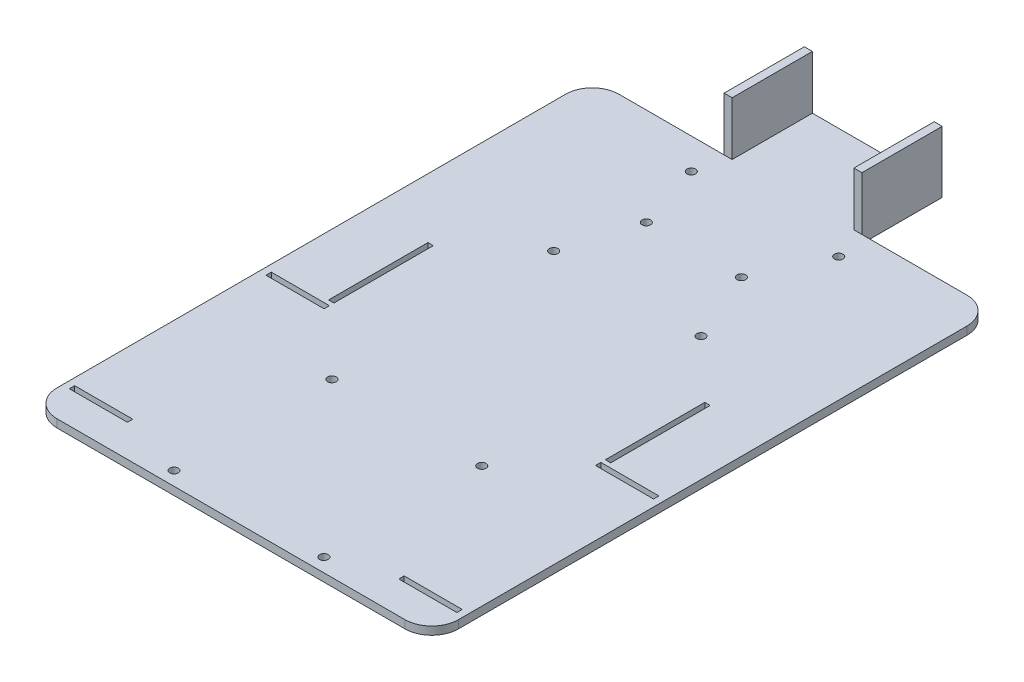
from build123d import *

# Parameters (mm, degrees)
BOSS_EXTRUDE1_DEPTH     = 3
SKETCH2_R               = 1.6
SKETCH2_W               = 21.700006253
SKETCH2_H               = 2
SKETCH2_W_2             = 2
SKETCH2_H_2             = 37.126830638
CUT_EXTRUDE1_DEPTH      = 155.463587942
SKETCH3_W               = 3
SKETCH3_H               = 30
BOSS_EXTRUDE2_DEPTH     = 20
FILLET2_R               = 10
CUT_EXTRUDE2_DEPTH      = 157.137759687
CUT_EXTRUDE2_DEPTH_BACK = 157.137759687
SKETCH5_R               = 1.6


with BuildPart() as part:
    # Sketch1 → Boss-Extrude1 (new body)
    with BuildSketch(Plane(origin=(0, 0, 0), x_dir=(1, 0, 0), z_dir=(0, 1, 0))):
        Polygon((-75, 105), (-25.75, 105), (-25.75, 135), (25.75, 135), (25.75, 105), (75, 105), (75, -105), (-75, -105), align=None)
    extrude(amount=BOSS_EXTRUDE1_DEPTH)

    # Sketch2 → Cut-Extrude1 (cut, through all)
    with BuildSketch(Plane(origin=(0, 3, 0), x_dir=(1, 0, 0), z_dir=(0, 1, 0))):
        with Locations(Location((-26.500321166, 93.505677214, 0), (0, 0, 270))):
            Circle(SKETCH2_R)
        with Locations(Location((28.569678834, 93.505677214, 0), (0, 0, 270))):
            Circle(SKETCH2_R)
        with Locations(Location((28.569678834, 42.065677214, 0), (0, 0, 270))):
            Circle(SKETCH2_R)
        with Locations(Location((-26.500321166, 42.065677214, 0), (0, 0, 270))):
            Circle(SKETCH2_R)
        with Locations(Location((-26.398287195, -40.891541183, 0), (0, 0, 270))):
            Circle(SKETCH2_R)
        with Locations(Location((29.601712805, -40.891541183, 0), (0, 0, 270))):
            Circle(SKETCH2_R)
        with Locations(Location((-26.398287195, -99.891541183, 0), (0, 0, 270))):
            Circle(SKETCH2_R)
        with Locations(Location((29.601712805, -99.891541183, 0), (0, 0, 270))):
            Circle(SKETCH2_R)
        with Locations((61.56254881, -18.52352323)):
            Rectangle(SKETCH2_W, SKETCH2_H)
        with Locations((-61.56254881, -18.52352323)):
            Rectangle(SKETCH2_W, SKETCH2_H)
        with Locations((51.712545683, 2.74325537)):
            Rectangle(SKETCH2_W_2, SKETCH2_H_2)
        with Locations((-51.712545683, 2.74325537)):
            Rectangle(SKETCH2_W_2, SKETCH2_H_2)
        with Locations((61.56254881, -91.993921103)):
            Rectangle(SKETCH2_W, SKETCH2_H)
        with Locations((-61.56254881, -91.993921103)):
            Rectangle(SKETCH2_W, SKETCH2_H)
    extrude(amount=-CUT_EXTRUDE1_DEPTH, mode=Mode.SUBTRACT)

    # Sketch3 → Boss-Extrude2 (add)
    with BuildSketch(Plane(origin=(0, 3, 0), x_dir=(1, 0, 0), z_dir=(0, 1, 0))):
        with Locations((-24.25, 120)):
            Rectangle(SKETCH3_W, SKETCH3_H)
        with Locations((24.25, 120)):
            Rectangle(SKETCH3_W, SKETCH3_H)
    extrude(amount=BOSS_EXTRUDE2_DEPTH)

    # Fillet2
    fillet2_edges = [part.edges().sort_by_distance(p)[0] for p in [
        (75, 1.5, 105),
        (-75, 1.5, 105),
        (-75, 1.5, -105),
        (75, 1.5, -105),
    ]]
    fillet(fillet2_edges, radius=FILLET2_R)

    # Sketch5 → Cut-Extrude2 (cut, two sides: drawn at the far end of the back side and taken through both)
    with BuildSketch(Plane.XZ.offset(-CUT_EXTRUDE2_DEPTH_BACK)):
        with Locations(Location((-18.452668306, -68.632073291, 0), (0, 0, 90))):
            Circle(SKETCH5_R)
        with Locations(Location((17.047331694, -68.632073291, 0), (0, 0, 90))):
            Circle(SKETCH5_R)
    extrude(amount=CUT_EXTRUDE2_DEPTH + CUT_EXTRUDE2_DEPTH_BACK, mode=Mode.SUBTRACT)


solid = part.part
